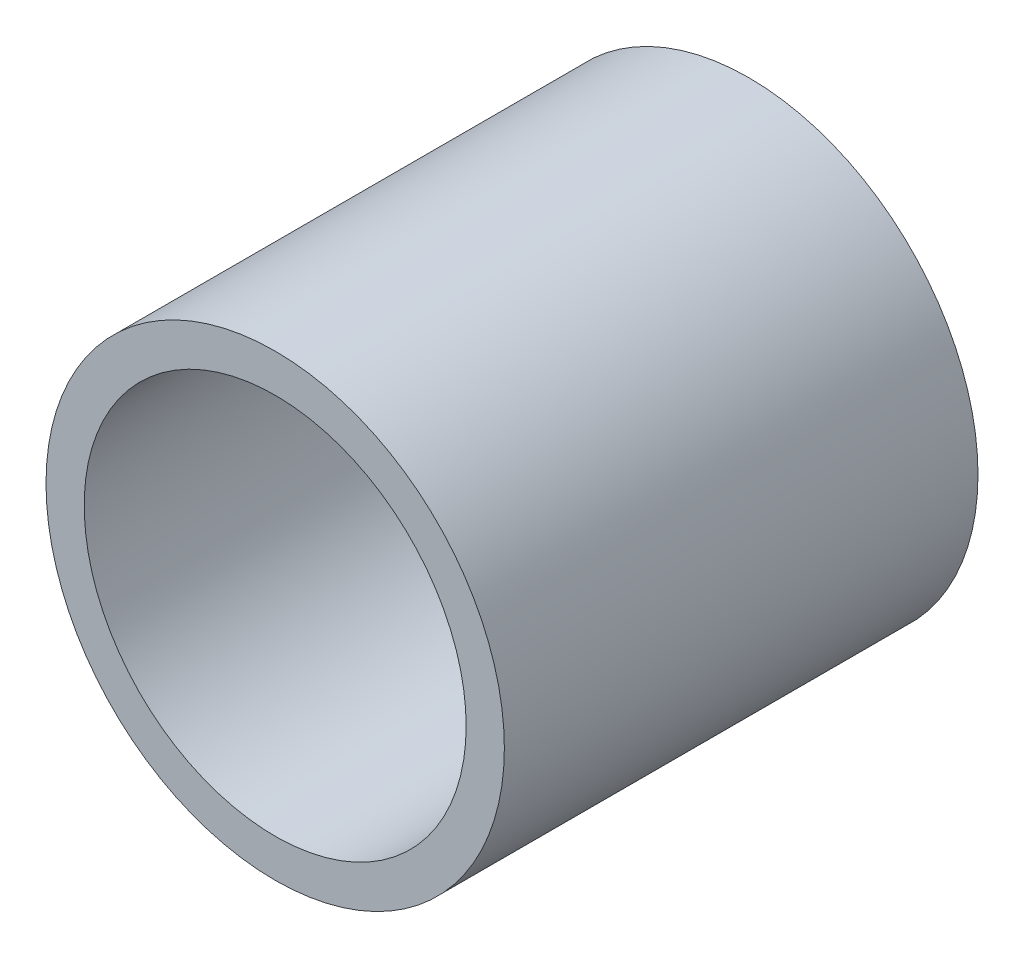
from build123d import *

# Parameters (mm, degrees)
SKETCH1_R           = 15
SKETCH1_R_2         = 12.5
BOSS_EXTRUDE1_DEPTH = 31


with BuildPart() as part:
    # Sketch1 → Boss-Extrude1 (new body)
    with BuildSketch(Plane.XY):
        Circle(SKETCH1_R)
        Circle(SKETCH1_R_2, mode=Mode.SUBTRACT)
    extrude(amount=BOSS_EXTRUDE1_DEPTH)


solid = part.part
